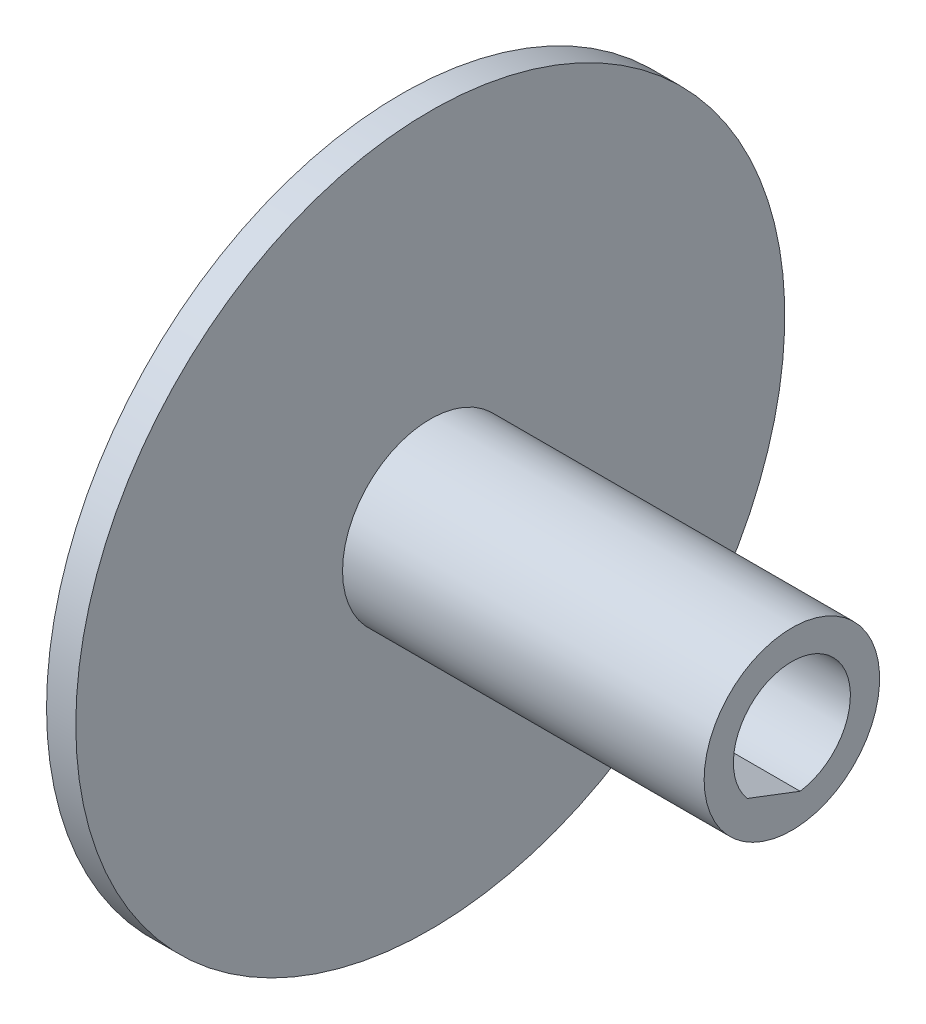
from build123d import *

# Parameters (mm, degrees)
BOSS_EXTRUDE1_DEPTH = 26.722785591


with BuildPart() as part:
    # Sketch1 → Revolve1 (revolve)
    with BuildSketch(Plane.XY, mode=Mode.PRIVATE) as revolve1_sk:
        Polygon((2, 5.01459854), (2, 21.253819403), (4, 21.253819403), (4, 3.01459854), (7, 3.01459854), (28.722785591, 3.01459854), (28.722785591, 1.01459854), (7, 1.01459854), (2, 1.01459854), align=None)
    revolve(revolve1_sk.sketch.rotate(Axis((2, -2.98540146, 0), (1, 0, 0)), 90), axis=Axis((2, -2.98540146, 0), (1, 0, 0)))

    # Sketch2 → Boss-Extrude1 (add)
    with BuildSketch(Plane.ZY.offset(-2)):
        with BuildLine():
            Line((-0.561713132, -6.945764872), (1.247578239, -6.255500623))
            Line((1.247578239, -6.255500623), (3.056869611, -5.565236374))
            ThreePointArc((3.056869611, -5.565236374), (1.425803702, -6.722657646), (-0.561713132, -6.945764872))
        make_face()
    extrude(amount=-BOSS_EXTRUDE1_DEPTH)


solid = part.part
